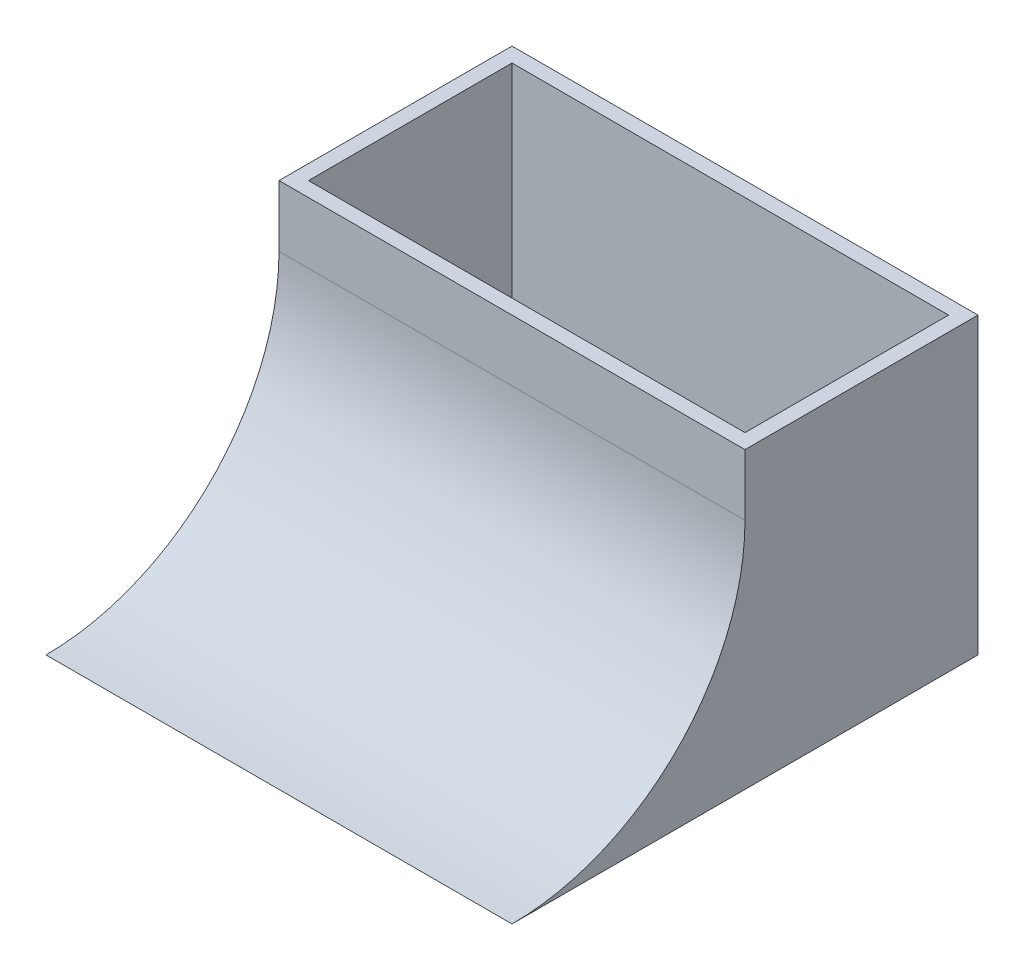
from build123d import *

# Parameters (mm, degrees)
ESBO_O3_W                  = 95
ESBO_O3_H                  = 95
RESSALTO_EXTRUS_O2_DEPTH   = 47.5
CORTE_EXTRUS_O1_DEPTH      = 117.350762782
CORTE_EXTRUS_O1_DEPTH_BACK = 117.350762782
ESBO_O4_R                  = 47.5
CORTE_EXTRUS_O2_DEPTH      = 83.27241336
CORTE_EXTRUS_O2_DEPTH_BACK = 83.27241336
CORTE_EXTRUS_O3_DEPTH      = 83.27241336
CORTE_EXTRUS_O3_DEPTH_BACK = 83.27241336
ESBO_O6_W                  = 47.5
ESBO_O6_H                  = 35
ESBO_O7_W                  = 89
ESBO_O7_H                  = 41.5
CORTE_EXTRUS_O4_DEPTH      = 57


with BuildPart() as part:
    # Esboço3 → Ressalto-extrusão2 (new, symmetric)
    with BuildSketch(Plane(origin=(0, 0, 0), x_dir=(0, 0, -1), z_dir=(1, 0, 0))):
        Rectangle(ESBO_O3_W, ESBO_O3_H)
    extrude(amount=RESSALTO_EXTRUS_O2_DEPTH, both=True)

    # Esboço4 → Corte-extrusão1 (cut, two sides: drawn at the far end of the back side and taken through both)
    with BuildSketch(Plane(origin=(47.5, 0, 0), x_dir=(0, 0, -1), z_dir=(1, 0, 0)).offset(-CORTE_EXTRUS_O1_DEPTH_BACK)):
        with Locations((-47.5, 0)):
            Circle(ESBO_O4_R)
    extrude(amount=CORTE_EXTRUS_O1_DEPTH + CORTE_EXTRUS_O1_DEPTH_BACK, mode=Mode.SUBTRACT)

    # Esboço5 → Corte-extrusão2 (cut, two sides: drawn at the far end of the back side and taken through both)
    with BuildSketch(Plane(origin=(0, 0, 0), x_dir=(0, 0, -1), z_dir=(1, 0, 0)).offset(-CORTE_EXTRUS_O2_DEPTH_BACK)):
        Polygon((0, 0), (0, 47.5), (-47.5, 47.5), align=None)
    extrude(amount=CORTE_EXTRUS_O2_DEPTH + CORTE_EXTRUS_O2_DEPTH_BACK, mode=Mode.SUBTRACT)

    # Esboço6 → Corte-extrusão3 (cut, two sides: drawn at the far end of the back side and taken through both)
    with BuildSketch(Plane(origin=(0, 0, 0), x_dir=(0, 0, -1), z_dir=(1, 0, 0)).offset(-CORTE_EXTRUS_O3_DEPTH_BACK)):
        with Locations((23.75, 30)):
            Rectangle(ESBO_O6_W, ESBO_O6_H)
    extrude(amount=CORTE_EXTRUS_O3_DEPTH + CORTE_EXTRUS_O3_DEPTH_BACK, mode=Mode.SUBTRACT)

    # Esboço7 → Corte-extrusão4 (cut)
    with BuildSketch(Plane(origin=(0, 12.5, 0), x_dir=(1, 0, 0), z_dir=(0, 1, 0))):
        with Locations((0, 23.75)):
            Rectangle(ESBO_O7_W, ESBO_O7_H)
    extrude(amount=-CORTE_EXTRUS_O4_DEPTH, mode=Mode.SUBTRACT)


solid = part.part
